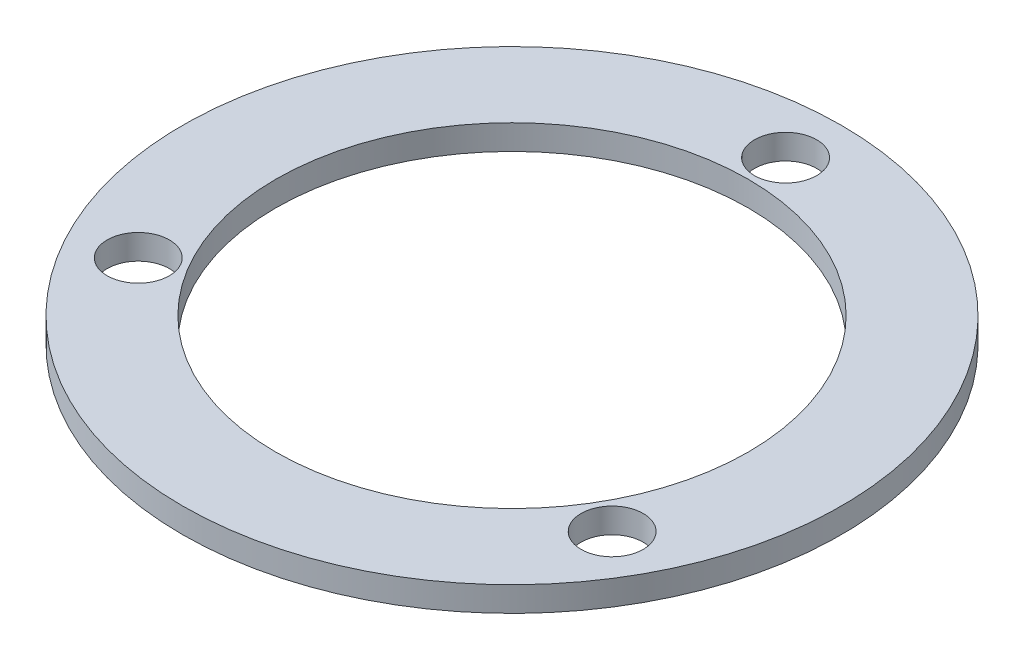
from build123d import *

# Parameters (mm, degrees)
SKETCH1_R           = 13.25
SKETCH1_R_2         = 9.5
SKETCH1_R_3         = 1.25
BOSS_EXTRUDE1_DEPTH = 1


with BuildPart() as part:
    # Sketch1 → Boss-Extrude1 (new body)
    with BuildSketch(Plane(origin=(0, 0, 0), x_dir=(1, 0, 0), z_dir=(0, 1, 0))):
        with Locations(Location((0, 0, 0), (0, 0, 270))):
            Circle(SKETCH1_R)
        with Locations(Location((0, 0, 0), (0, 0, 270))):
            Circle(SKETCH1_R_2, mode=Mode.SUBTRACT)
        with Locations(Location((0, 11, 0), (0, 0, 270))):
            Circle(SKETCH1_R_3, mode=Mode.SUBTRACT)
        with Locations(Location((9.526279442, -5.5, 0), (0, 0, 270))):
            Circle(SKETCH1_R_3, mode=Mode.SUBTRACT)
        with Locations(Location((-9.526279442, -5.5, 0), (0, 0, 270))):
            Circle(SKETCH1_R_3, mode=Mode.SUBTRACT)
    extrude(amount=BOSS_EXTRUDE1_DEPTH)


solid = part.part
